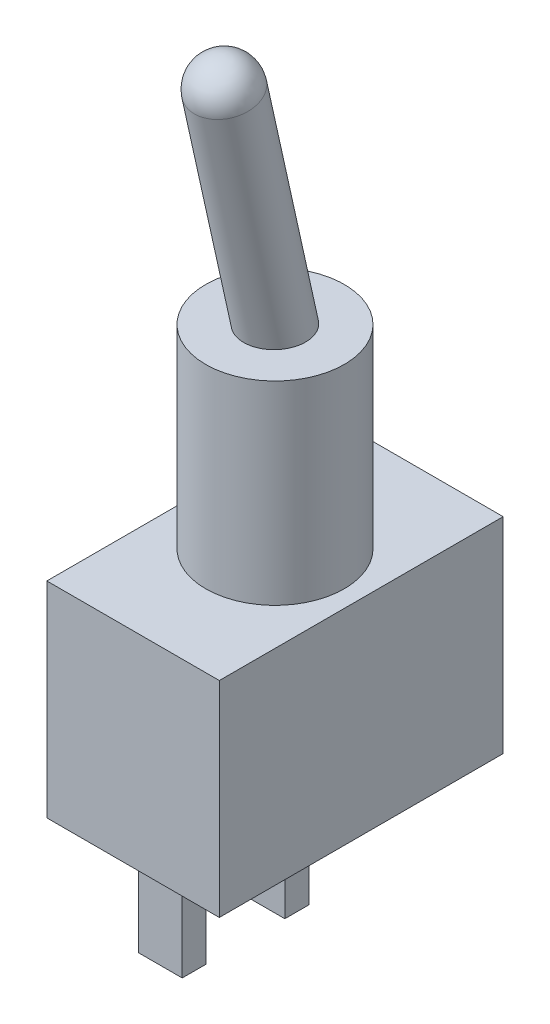
from build123d import *

# Parameters (mm, degrees)
SKETCH1_W           = 7.9
SKETCH1_H           = 13
BOSS_EXTRUDE1_DEPTH = 9.4
SKETCH2_W           = 2
SKETCH2_H           = 1.1
BOSS_EXTRUDE2_DEPTH = 4.5
SKETCH3_R           = 3.175
BOSS_EXTRUDE3_DEPTH = 8.9


with BuildPart() as part:
    # Sketch1 → Boss-Extrude1 (new body)
    with BuildSketch(Plane(origin=(0, 0, 0), x_dir=(1, 0, 0), z_dir=(0, 1, 0))):
        Rectangle(SKETCH1_W, SKETCH1_H)
    extrude(amount=-BOSS_EXTRUDE1_DEPTH)

    # Sketch2 → Boss-Extrude2 (add)
    with BuildSketch(Plane.XZ.offset(9.4)):
        with Locations((0, 4.7)):
            Rectangle(SKETCH2_W, SKETCH2_H)
        Rectangle(SKETCH2_W, SKETCH2_H)
    extrude(amount=BOSS_EXTRUDE2_DEPTH)

    # Sketch3 → Boss-Extrude3 (add)
    with BuildSketch(Plane(origin=(0, 0, 0), x_dir=(1, 0, 0), z_dir=(0, 1, 0))):
        with Locations(Location((0, 0, 0), (0, 0, 270))):
            Circle(SKETCH3_R)
    extrude(amount=BOSS_EXTRUDE3_DEPTH)

    # Sketch4 → Revolve1 (revolve)
    with BuildSketch(Plane(origin=(0, 0, 0), x_dir=(0, 0, -1), z_dir=(1, 0, 0)), mode=Mode.PRIVATE) as revolve1_sk:
        with BuildLine():
            Line((0, 8.9), (1.43399132, 8.9))
            Line((1.43399132, 8.9), (-0.960979548, 19.70301546))
            ThreePointArc((-0.960979548, 19.70301546), (-1.575574506, 20.580748024), (-2.630809417, 20.76681441))
            Line((-2.630809417, 20.76681441), (0, 8.9))
        make_face()
    revolve(revolve1_sk.sketch.rotate(Axis((0, 20.76681441, 2.630809417), (0, -0.9762960071199331, -0.21643961393810368)), 180), axis=Axis((0, 20.76681441, 2.630809417), (0, -0.9762960071199331, -0.21643961393810368)))


solid = part.part
